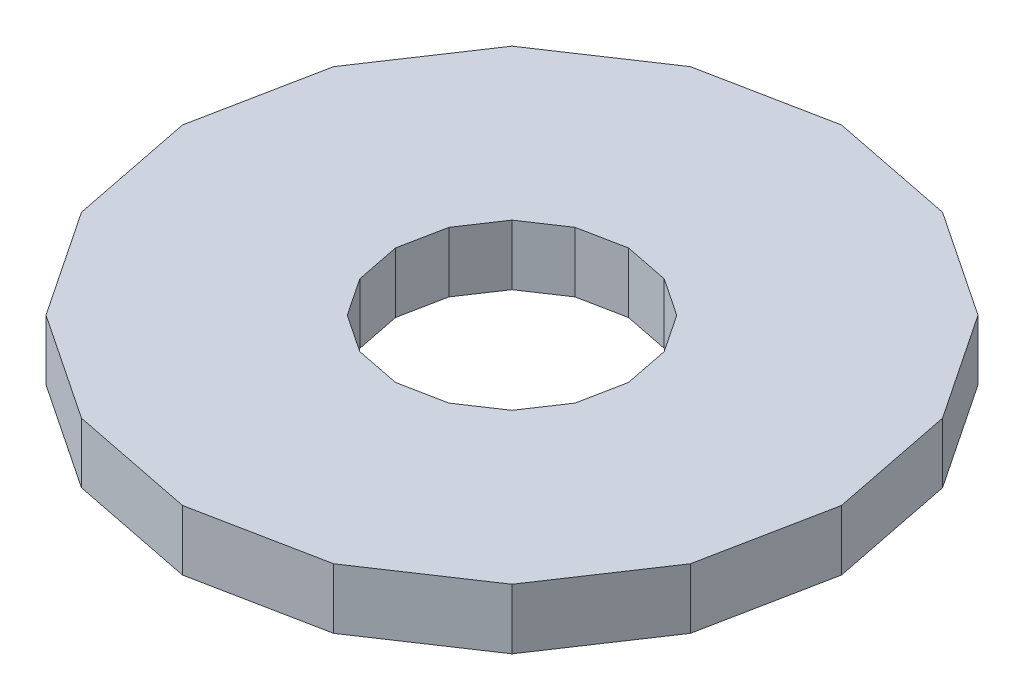
from build123d import *

# Parameters (mm, degrees)
BOSS_EXTRUDE1_DEPTH = 19.05


with BuildPart() as part:
    # Sketch1 → Boss-Extrude1 (new body)
    with BuildSketch(Plane(origin=(0, 0, 0), x_dir=(1, 0, 0), z_dir=(0, 1, 0))):
        Polygon((104.156883796, 0), (96.228413109, 39.859113796), (73.65003884, 73.65003884), (39.859113796, 96.228413109), (0, 104.156883796), (-39.859113796, 96.228413109), (-73.65003884, 73.65003884), (-96.228413109, 39.859113796), (-104.156883796, 0), (-96.228413109, -39.859113796), (-73.65003884, -73.65003884), (-39.859113796, -96.228413109), (0, -104.156883796), (39.859113796, -96.228413109), (73.65003884, -73.65003884), (96.228413109, -39.859113796), align=None)
        Polygon((36.823083708, 0), (34.020093362, 14.091584064), (26.037852194, 26.037852194), (14.091584064, 34.020093362), (0, 36.823083708), (-14.091584064, 34.020093362), (-26.037852194, 26.037852194), (-34.020093362, 14.091584064), (-36.823083708, 0), (-34.020093362, -14.091584064), (-26.037852194, -26.037852194), (-14.091584064, -34.020093362), (0, -36.823083708), (14.091584064, -34.020093362), (26.037852194, -26.037852194), (34.020093362, -14.091584064), align=None, mode=Mode.SUBTRACT)
    extrude(amount=BOSS_EXTRUDE1_DEPTH)


solid = part.part
